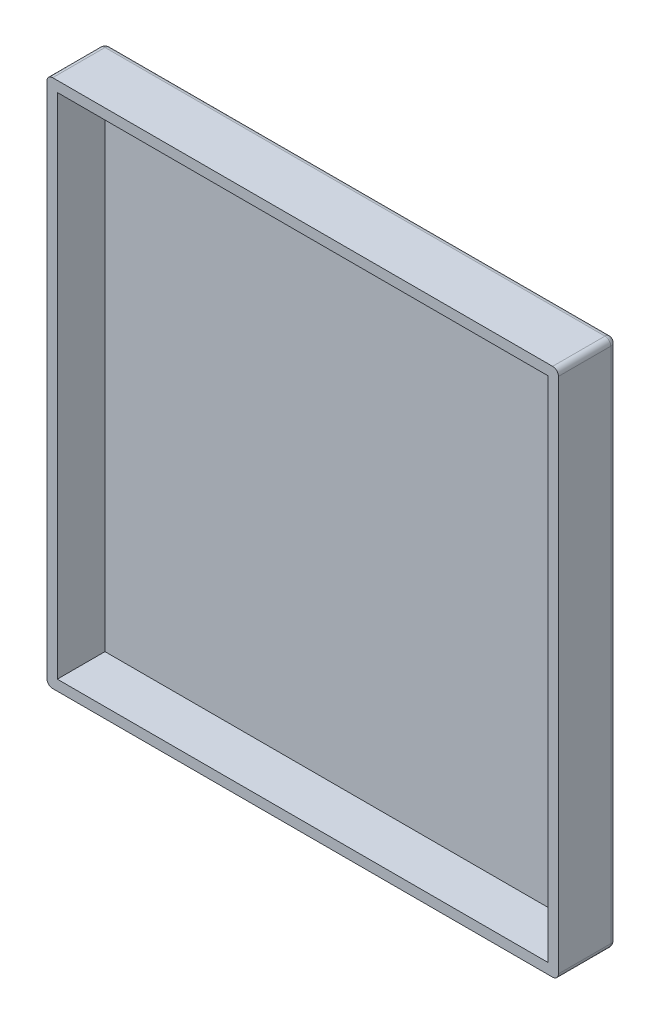
from build123d import *

# Parameters (mm, degrees)
SKETCH_FOR_MAIN_SHAPE_W = 88
SKETCH_FOR_MAIN_SHAPE_H = 91
MAIN_SHAPE_DEPTH        = 10
HOLLOW_T                = -1.8
FILLETS_R               = 1


with BuildPart() as part:
    # Sketch for main shape → Main shape (new body)
    with BuildSketch(Plane.XY):
        with Locations((44, 45.5)):
            Rectangle(SKETCH_FOR_MAIN_SHAPE_W, SKETCH_FOR_MAIN_SHAPE_H)
    extrude(amount=MAIN_SHAPE_DEPTH)

    # Hollow
    hollow_openings = [part.faces().sort_by_distance(p)[0] for p in [
        (44, 45.5, 10),
    ]]
    offset(amount=HOLLOW_T, openings=hollow_openings, kind=Kind.INTERSECTION)

    # Fillets
    fillets_edges = [part.edges().sort_by_distance(p)[0] for p in [
        (44, 91, 0),
        (88, 45.5, 0),
        (44, 0, 0),
        (0, 45.5, 0),
        (0, 91, 5),
        (88, 91, 5),
        (88, 0, 5),
        (0, 0, 5),
    ]]
    fillet(fillets_edges, radius=FILLETS_R)


solid = part.part
